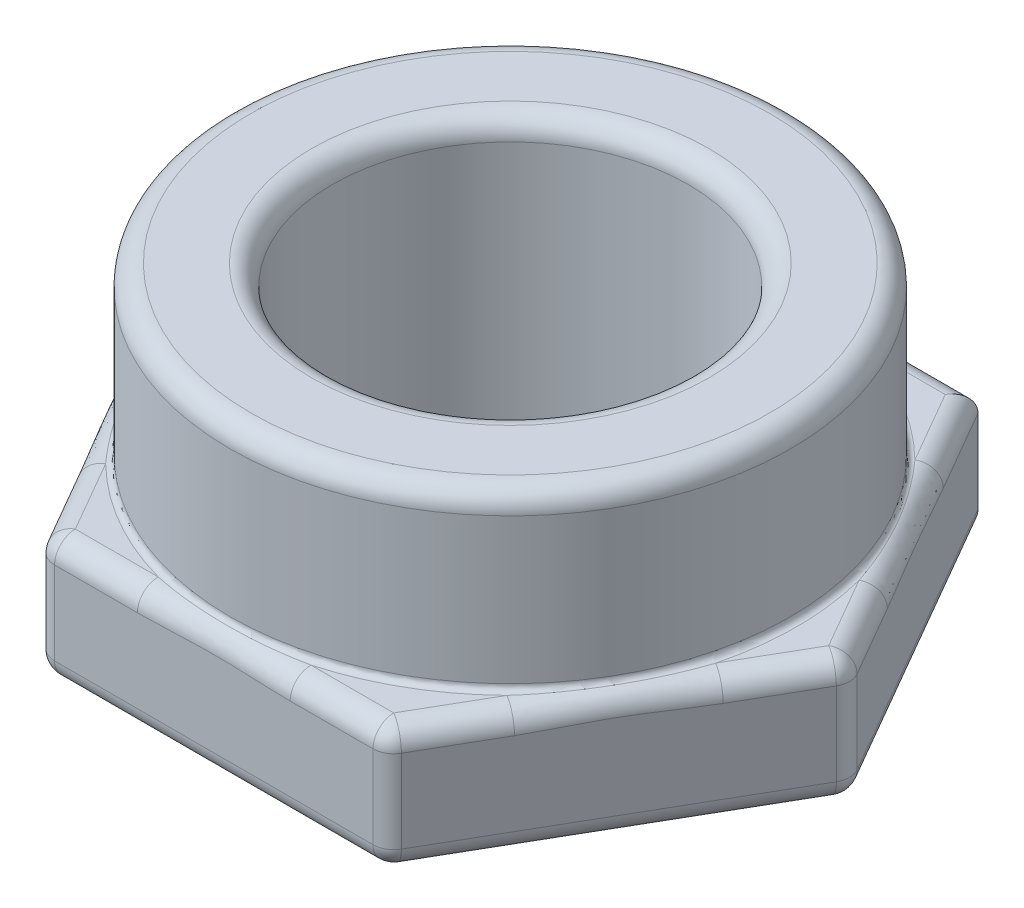
from build123d import *

# Parameters (mm, degrees)
BOSS_EXTRUDE1_DEPTH = 10.668
SKETCH2_R           = 24.003
BOSS_EXTRUDE2_DEPTH = 14.732
SKETCH3_R           = 15.24
CUT_EXTRUDE1_DEPTH  = 47.373843202
FILLET2_R           = 0.508
FILLET1_R           = 1.778


with BuildPart() as part:
    # Sketch1 → Boss-Extrude1 (new body)
    with BuildSketch(Plane(origin=(0, 0, 0), x_dir=(1, 0, 0), z_dir=(0, 1, 0))):
        Polygon((29.329393675, 0), (14.664696837, 25.4), (-14.664696837, 25.4), (-29.329393675, 0), (-14.664696837, -25.4), (14.664696837, -25.4), align=None)
    extrude(amount=BOSS_EXTRUDE1_DEPTH)

    # Sketch2 → Boss-Extrude2 (add)
    with BuildSketch(Plane(origin=(0, 10.668, 0), x_dir=(1, 0, 0), z_dir=(0, 1, 0))):
        with Locations(Location((0, 0, 0), (0, 0, 270))):
            Circle(SKETCH2_R)
    extrude(amount=BOSS_EXTRUDE2_DEPTH)

    # Sketch3 → Cut-Extrude1 (cut, through all)
    with BuildSketch(Plane(origin=(0, 25.4, 0), x_dir=(1, 0, 0), z_dir=(0, 1, 0))):
        with Locations(Location((0, 0, 0), (0, 0, 270))):
            Circle(SKETCH3_R)
    extrude(amount=-CUT_EXTRUDE1_DEPTH, mode=Mode.SUBTRACT)

    # Fillet2
    fillet2_edges = [part.edges().sort_by_distance(p)[0] for p in [
        (0, 10.668, -24.003),
    ]]
    fillet(fillet2_edges, radius=FILLET2_R)

    # Fillet1
    fillet1_edges = [part.edges().sort_by_distance(p)[0] for p in [
        (0, 10.668, -25.4),
        (14.664696837, 5.334, 25.4),
        (-14.664696837, 5.334, 25.4),
        (-29.329393675, 5.334, 0),
        (-14.664696837, 5.334, -25.4),
        (29.329393675, 5.334, 0),
        (-21.997045256, 10.668, -12.7),
        (-21.997045256, 10.668, 12.7),
        (0, 10.668, 25.4),
        (0, 25.4, -24.003),
        (0, 0, -15.24),
        (0, 25.4, -15.24),
        (21.997045256, 10.668, 12.7),
        (0, 0, 25.4),
        (-21.997045256, 0, 12.7),
        (-21.997045256, 0, -12.7),
        (21.997045256, 10.668, -12.7),
        (0, 0, -25.4),
        (21.997045256, 0, -12.7),
        (21.997045256, 0, 12.7),
    ]]
    fillet(fillet1_edges, radius=FILLET1_R)


solid = part.part
